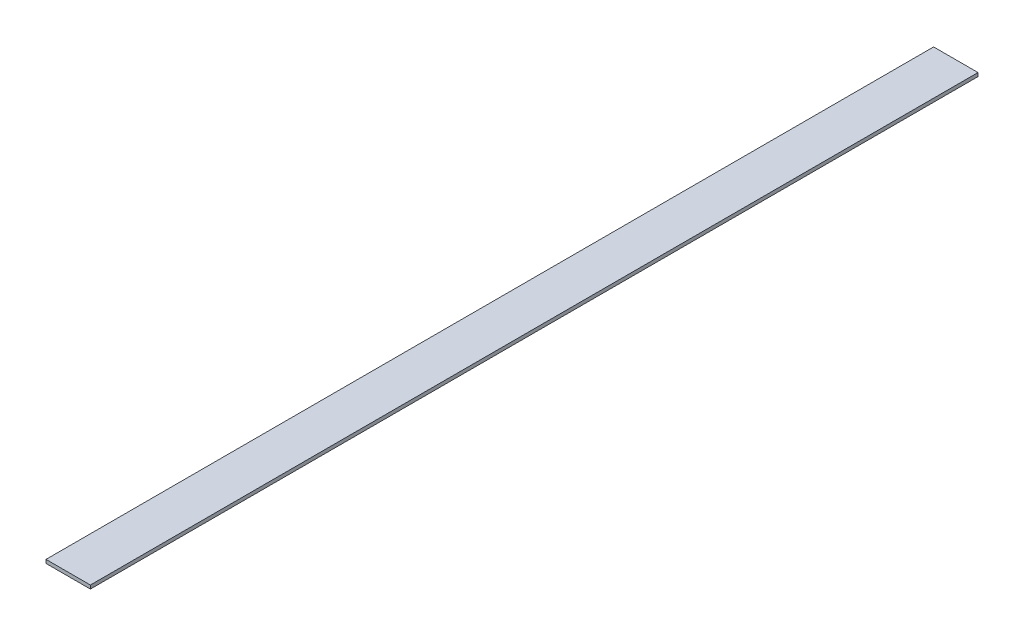
from build123d import *

# Parameters (mm, degrees)
BOSS_EXTRUDE1_DEPTH = 500
SKETCH2_R           = 2
CUT_EXTRUDE1_DEPTH  = 10
CUT_EXTRUDE2_DEPTH  = 10


with BuildPart() as part:
    # Sketch1 → Boss-Extrude1 (new body)
    with BuildSketch(Plane.XY):
        Polygon((0, 25), (0, 0), (2, 0), (2, 23), (25, 23), (25, 25), (5, 25), align=None)
    extrude(amount=BOSS_EXTRUDE1_DEPTH)

    # Sketch2 → Cut-Extrude1 (cut)
    with BuildSketch(Plane.ZY):
        with Locations(Location((100, 12.5, 0), (0, 0, 270))):
            Circle(SKETCH2_R)
        with Locations(Location((200, 12.5, 0), (0, 0, 270))):
            Circle(SKETCH2_R)
        with Locations(Location((300, 12.5, 0), (0, 0, 270))):
            Circle(SKETCH2_R)
        with Locations(Location((400, 12.5, 0), (0, 0, 270))):
            Circle(SKETCH2_R)
    extrude(amount=-CUT_EXTRUDE1_DEPTH, mode=Mode.SUBTRACT)

    # Sketch3 → Cut-Extrude2 (cut)
    with BuildSketch(Plane.ZY):
        Polygon((23, 0), (0, 23), (0, 0), align=None)
        Polygon((500, 23), (477, 0), (500, 0), align=None)
    extrude(amount=-CUT_EXTRUDE2_DEPTH, mode=Mode.SUBTRACT)


solid = part.part
